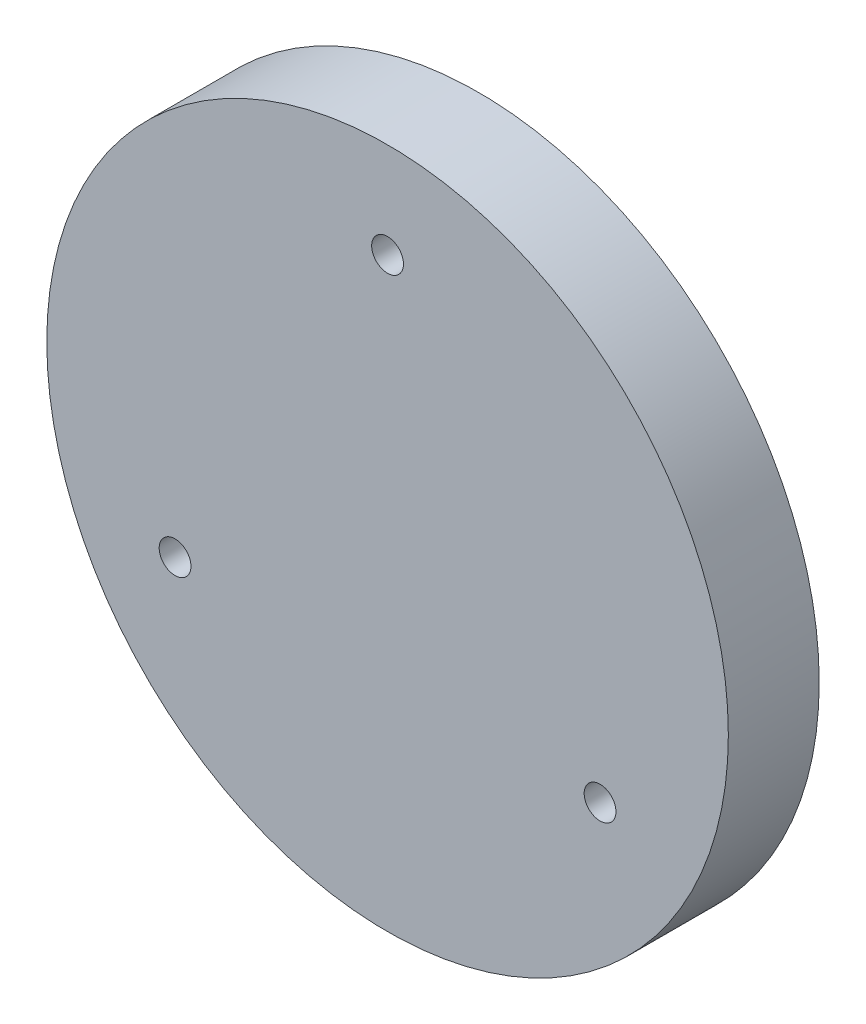
from build123d import *

# Parameters (mm, degrees)
SKETCH1_R           = 37.5
SKETCH1_R_2         = 1.75
BOSS_EXTRUDE1_DEPTH = 10


with BuildPart() as part:
    # Sketch1 → Boss-Extrude1 (new body)
    with BuildSketch(Plane.XY):
        Circle(SKETCH1_R)
        with Locations((0, 27)):
            Circle(SKETCH1_R_2, mode=Mode.SUBTRACT)
        with Locations((23.382685902, -13.5)):
            Circle(SKETCH1_R_2, mode=Mode.SUBTRACT)
        with Locations((-23.382685902, -13.5)):
            Circle(SKETCH1_R_2, mode=Mode.SUBTRACT)
    extrude(amount=BOSS_EXTRUDE1_DEPTH)


solid = part.part
